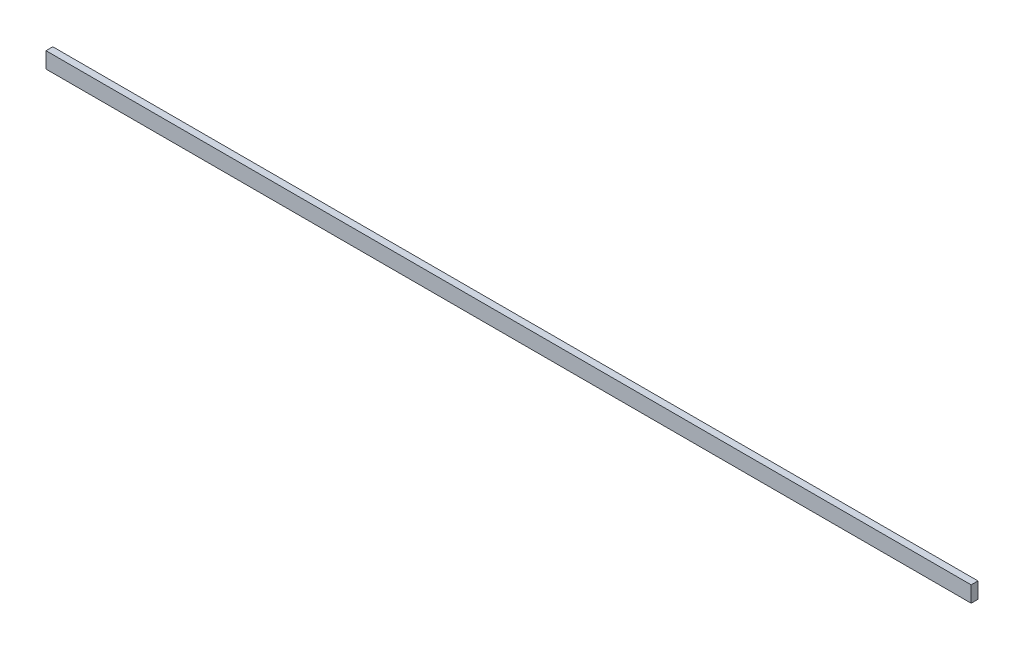
from build123d import *

# Parameters (mm, degrees)
SKETCH1_W           = 88.9
SKETCH1_H           = 38.1
BOSS_EXTRUDE1_DEPTH = 5161.28


with BuildPart() as part:
    # Sketch1 → Boss-Extrude1 (new body)
    with BuildSketch(Plane.YZ):
        Rectangle(SKETCH1_W, SKETCH1_H)
    extrude(amount=BOSS_EXTRUDE1_DEPTH)


solid = part.part
